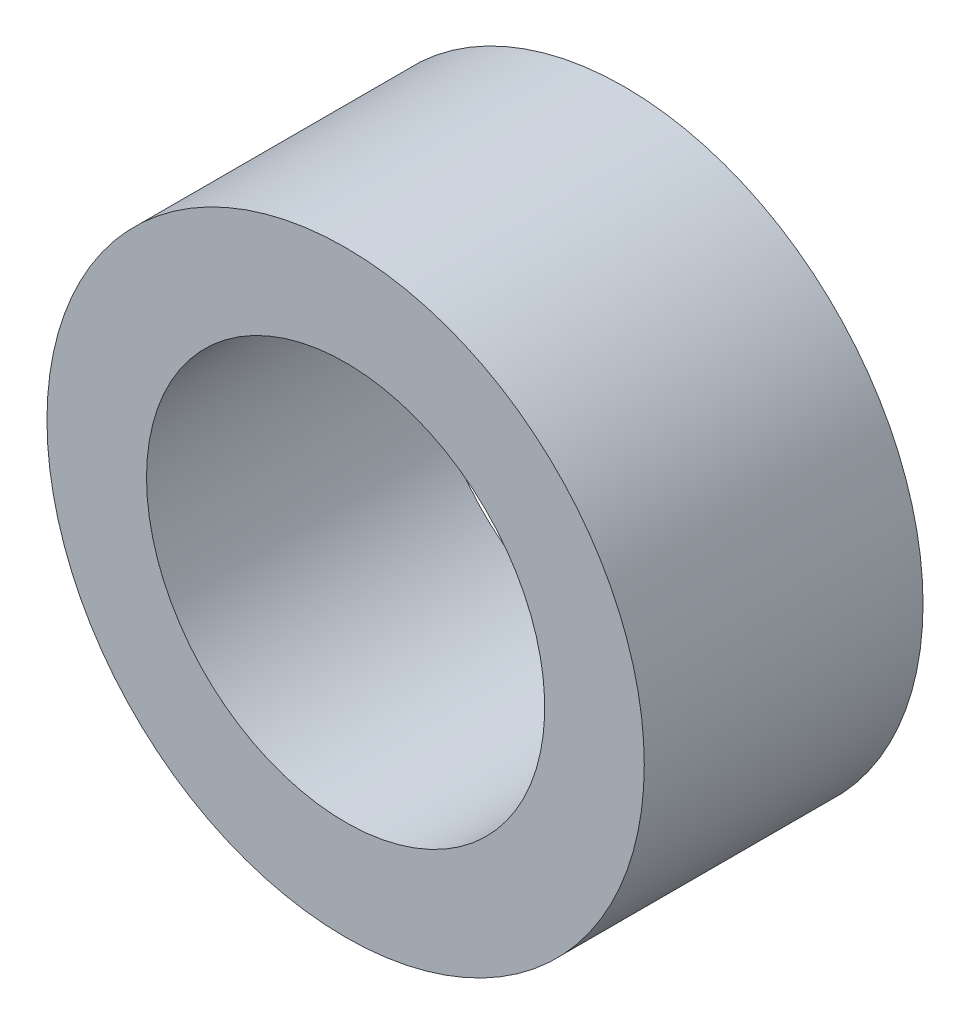
from build123d import *

# Parameters (mm, degrees)
SKETCH1_R           = 30
SKETCH1_R_2         = 20
BOSS_EXTRUDE1_DEPTH = 14


with BuildPart() as part:
    # Sketch1 → Boss-Extrude1 (new, symmetric)
    with BuildSketch(Plane.XY):
        with Locations(Location((0, 0, 0), (0, 0, 180))):
            Circle(SKETCH1_R)
        with Locations(Location((0, 0, 0), (0, 0, 180))):
            Circle(SKETCH1_R_2, mode=Mode.SUBTRACT)
    extrude(amount=BOSS_EXTRUDE1_DEPTH, both=True)


solid = part.part
